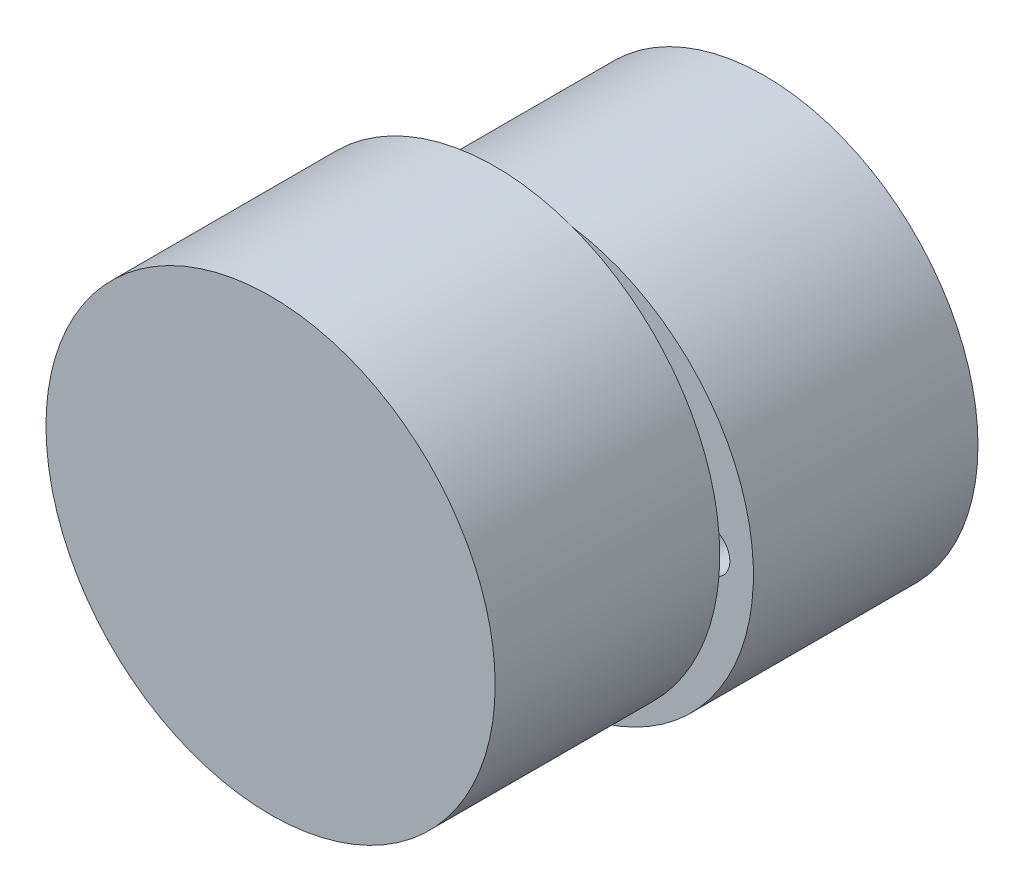
from build123d import *

# Parameters (mm, degrees)
SKETCH1_R           = 9.5
SKETCH1_R_2         = 1.6
SKETCH1_R_3         = 0.95
BOSS_EXTRUDE1_DEPTH = 10
SKETCH2_R           = 10
BOSS_EXTRUDE2_DEPTH = 10
SKETCH5_R           = 5.5
CUT_EXTRUDE1_DEPTH  = 1.2


with BuildPart() as part:
    # Sketch1 → Boss-Extrude1 (new body)
    with BuildSketch(Plane.XY):
        Circle(SKETCH1_R)
        Circle(SKETCH1_R_2, mode=Mode.SUBTRACT)
        with Locations((-7.5, 0)):
            Circle(SKETCH1_R_3, mode=Mode.SUBTRACT)
        with Locations((-5.303300859, 5.303300859)):
            Circle(SKETCH1_R_3, mode=Mode.SUBTRACT)
        with Locations((0, 7.5)):
            Circle(SKETCH1_R_3, mode=Mode.SUBTRACT)
        with Locations((5.303300859, 5.303300859)):
            Circle(SKETCH1_R_3, mode=Mode.SUBTRACT)
        with Locations((7.5, 0)):
            Circle(SKETCH1_R_3, mode=Mode.SUBTRACT)
        with Locations((5.303300859, -5.303300859)):
            Circle(SKETCH1_R_3, mode=Mode.SUBTRACT)
        with Locations((0, -7.5)):
            Circle(SKETCH1_R_3, mode=Mode.SUBTRACT)
        with Locations((-5.303300859, -5.303300859)):
            Circle(SKETCH1_R_3, mode=Mode.SUBTRACT)
    extrude(amount=BOSS_EXTRUDE1_DEPTH)

    # Sketch2 → Boss-Extrude2 (add)
    with BuildSketch(Plane.XY.offset(10)):
        with Locations(Location((-2, 0, 0), (0, 0, 69.894490212))):
            Circle(SKETCH2_R)
    extrude(amount=BOSS_EXTRUDE2_DEPTH)

    # Sketch5 → Cut-Extrude1 (cut)
    with BuildSketch(Plane(origin=(0, 0, 0), x_dir=(-1, 0, 0), z_dir=(0, 0, -1))):
        Circle(SKETCH5_R)
    extrude(amount=-CUT_EXTRUDE1_DEPTH, mode=Mode.SUBTRACT)


solid = part.part
